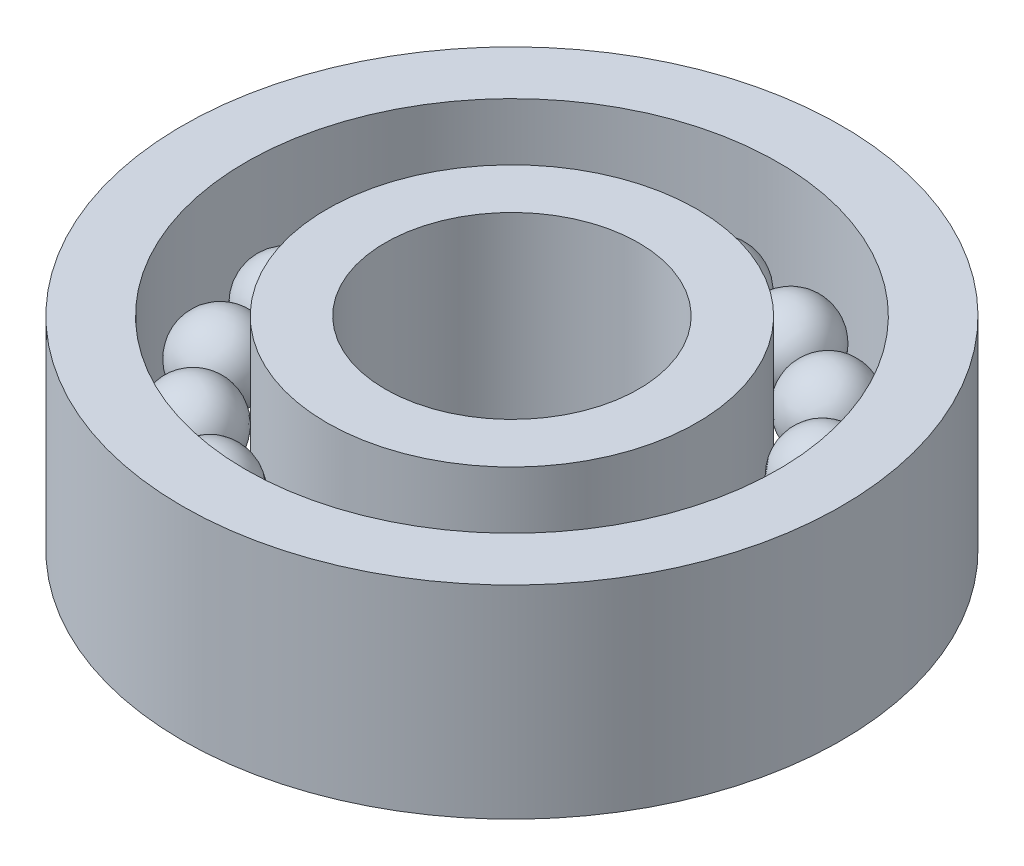
from build123d import *

# Parameters (mm, degrees)
SKETCH_1_R               = 6.5
SKETCH_1_R_2             = 2.5
EXTRUDE_1_DEPTH          = 2
SKETCH_2_R               = 5.25
SKETCH_2_R_2             = 3.65
CUT_EXTRUDE_2_DEPTH      = 11.024968828
PATTERN_CIRCULAR_4_COUNT = 17


with BuildPart() as part:
    # 草图1 → 凸台-拉伸1 (new, symmetric)
    with BuildSketch(Plane(origin=(0, 0, 0), x_dir=(1, 0, 0), z_dir=(0, 1, 0))):
        with Locations(Location((0, 0, 0), (0, 0, 270))):
            Circle(SKETCH_1_R)
        with Locations(Location((0, 0, 0), (0, 0, 270))):
            Circle(SKETCH_1_R_2, mode=Mode.SUBTRACT)
    extrude(amount=EXTRUDE_1_DEPTH, both=True)

    # 草图2 → 切除-拉伸2 (cut, through all)
    with BuildSketch(Plane(origin=(0, 2, 0), x_dir=(1, 0, 0), z_dir=(0, 1, 0))):
        with Locations(Location((0, 0, 0), (0, 0, 270))):
            Circle(SKETCH_2_R)
        with Locations(Location((0, 0, 0), (0, 0, 270))):
            Circle(SKETCH_2_R_2, mode=Mode.SUBTRACT)
    extrude(amount=-CUT_EXTRUDE_2_DEPTH, mode=Mode.SUBTRACT)


with BuildPart() as cut_extrude_2_piece_1:
    # of the separate pieces the step leaves, piece 1, a body of its own (cut_extrude_2_pieces)
    add(part.part.solids().sort_by_distance((0, -2, 6.5))[0])


with BuildPart() as cut_extrude_2_piece_2:
    # of the separate pieces the step leaves, piece 2, a body of its own (cut_extrude_2_pieces)
    add(part.part.solids().sort_by_distance((0, -2, 3.65))[0])


with BuildPart() as body_3:
    # 草图4 → 旋转5 (revolve)
    with BuildSketch(Plane(origin=(0, 0, 0), x_dir=(1, 0, 0), z_dir=(0, 1, 0))):
        with BuildLine():
            Line((-4.45, 0.8), (-4.45, -0.8))
            ThreePointArc((-4.45, -0.8), (-3.65, 0), (-4.45, 0.8))
        make_face()
    revolve(axis=Axis((-4.45, 0, -2.218864941), (0, 0, 1)))


with BuildPart() as pattern_circular_4_1:
    # 阵列(圆周)4: pattern copy
    add(body_3.part.rotate(Axis((0, 0, 0), (0, 1, 0)), 1 * 360 / PATTERN_CIRCULAR_4_COUNT))


with BuildPart() as pattern_circular_4_2:
    # 阵列(圆周)4: pattern copy
    add(body_3.part.rotate(Axis((0, 0, 0), (0, 1, 0)), 2 * 360 / PATTERN_CIRCULAR_4_COUNT))


with BuildPart() as pattern_circular_4_3:
    # 阵列(圆周)4: pattern copy
    add(body_3.part.rotate(Axis((0, 0, 0), (0, 1, 0)), 3 * 360 / PATTERN_CIRCULAR_4_COUNT))


with BuildPart() as pattern_circular_4_4:
    # 阵列(圆周)4: pattern copy
    add(body_3.part.rotate(Axis((0, 0, 0), (0, 1, 0)), 4 * 360 / PATTERN_CIRCULAR_4_COUNT))


with BuildPart() as pattern_circular_4_5:
    # 阵列(圆周)4: pattern copy
    add(body_3.part.rotate(Axis((0, 0, 0), (0, 1, 0)), 5 * 360 / PATTERN_CIRCULAR_4_COUNT))


with BuildPart() as pattern_circular_4_6:
    # 阵列(圆周)4: pattern copy
    add(body_3.part.rotate(Axis((0, 0, 0), (0, 1, 0)), 6 * 360 / PATTERN_CIRCULAR_4_COUNT))


with BuildPart() as pattern_circular_4_7:
    # 阵列(圆周)4: pattern copy
    add(body_3.part.rotate(Axis((0, 0, 0), (0, 1, 0)), 7 * 360 / PATTERN_CIRCULAR_4_COUNT))


with BuildPart() as pattern_circular_4_8:
    # 阵列(圆周)4: pattern copy
    add(body_3.part.rotate(Axis((0, 0, 0), (0, 1, 0)), 8 * 360 / PATTERN_CIRCULAR_4_COUNT))


with BuildPart() as pattern_circular_4_9:
    # 阵列(圆周)4: pattern copy
    add(body_3.part.rotate(Axis((0, 0, 0), (0, 1, 0)), 9 * 360 / PATTERN_CIRCULAR_4_COUNT))


with BuildPart() as pattern_circular_4_10:
    # 阵列(圆周)4: pattern copy
    add(body_3.part.rotate(Axis((0, 0, 0), (0, 1, 0)), 10 * 360 / PATTERN_CIRCULAR_4_COUNT))


with BuildPart() as pattern_circular_4_11:
    # 阵列(圆周)4: pattern copy
    add(body_3.part.rotate(Axis((0, 0, 0), (0, 1, 0)), 11 * 360 / PATTERN_CIRCULAR_4_COUNT))


with BuildPart() as pattern_circular_4_12:
    # 阵列(圆周)4: pattern copy
    add(body_3.part.rotate(Axis((0, 0, 0), (0, 1, 0)), 12 * 360 / PATTERN_CIRCULAR_4_COUNT))


with BuildPart() as pattern_circular_4_13:
    # 阵列(圆周)4: pattern copy
    add(body_3.part.rotate(Axis((0, 0, 0), (0, 1, 0)), 13 * 360 / PATTERN_CIRCULAR_4_COUNT))


with BuildPart() as pattern_circular_4_14:
    # 阵列(圆周)4: pattern copy
    add(body_3.part.rotate(Axis((0, 0, 0), (0, 1, 0)), 14 * 360 / PATTERN_CIRCULAR_4_COUNT))


with BuildPart() as pattern_circular_4_15:
    # 阵列(圆周)4: pattern copy
    add(body_3.part.rotate(Axis((0, 0, 0), (0, 1, 0)), 15 * 360 / PATTERN_CIRCULAR_4_COUNT))


with BuildPart() as pattern_circular_4_16:
    # 阵列(圆周)4: pattern copy
    add(body_3.part.rotate(Axis((0, 0, 0), (0, 1, 0)), 16 * 360 / PATTERN_CIRCULAR_4_COUNT))


solid = Compound([cut_extrude_2_piece_1.part, cut_extrude_2_piece_2.part, body_3.part, pattern_circular_4_1.part, pattern_circular_4_2.part, pattern_circular_4_3.part, pattern_circular_4_4.part, pattern_circular_4_5.part, pattern_circular_4_6.part, pattern_circular_4_7.part, pattern_circular_4_8.part, pattern_circular_4_9.part, pattern_circular_4_10.part, pattern_circular_4_11.part, pattern_circular_4_12.part, pattern_circular_4_13.part, pattern_circular_4_14.part, pattern_circular_4_15.part, pattern_circular_4_16.part])
